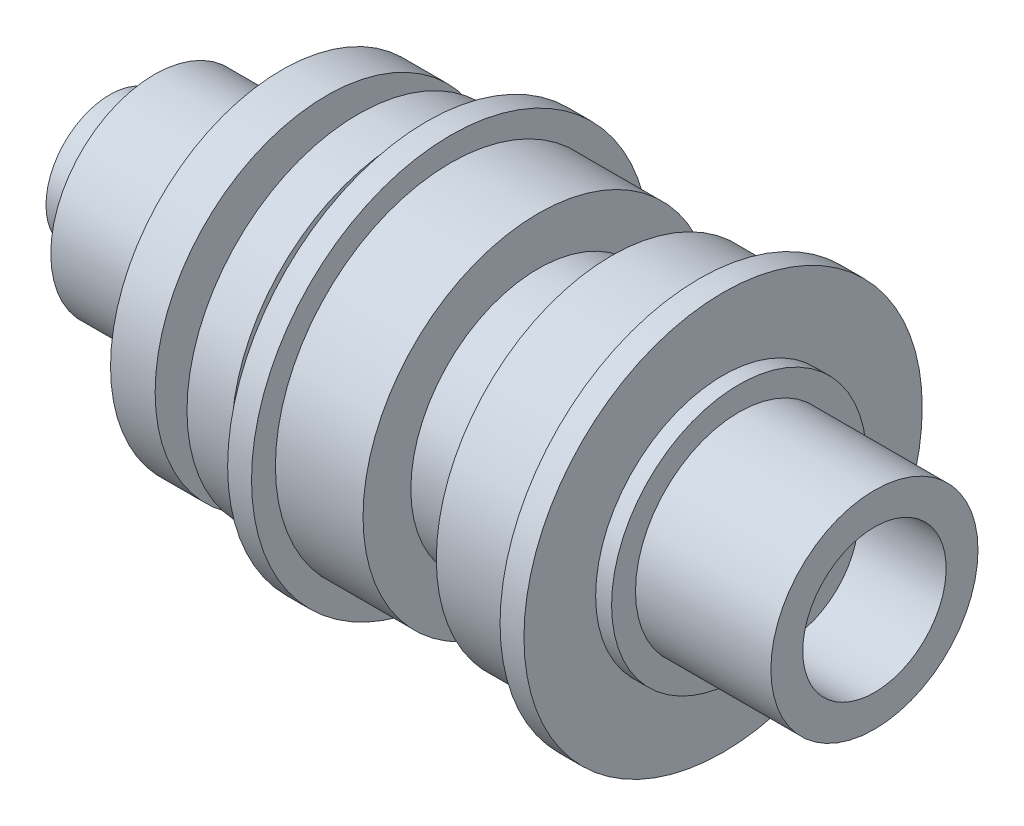
from build123d import *


with BuildPart() as part:
    # Sketch1 → Revolve1 (revolve)
    with BuildSketch(Plane.XY, mode=Mode.PRIVATE) as revolve1_sk:
        Polygon((10.8, 6.5), (2.8, 6.5), (2.8, 4), (0, 4), (0, 0), (42.5, 0), (42.5, 4.5), (48, 4.5), (48, 6.5), (39.5, 6.5), (39.5, 8), (38.5, 8), (38.5, 12.5), (37, 12.5), (37, 11), (31.5, 11), (31.5, 8), (26.9, 8), (26.9, 11), (21.4, 11), (21.4, 12.5), (19.9, 12.5), (19.9, 8), (18.4, 8), (18.4, 10.75), (15.6, 10.75), (15.6, 4), (13.6, 4), (13.6, 10.75), (10.8, 10.75), align=None)
    revolve(revolve1_sk.sketch.rotate(Axis((-10.695200226, 0, 0), (1, 0, 0)), 90), axis=Axis((-10.695200226, 0, 0), (1, 0, 0)))


solid = part.part
